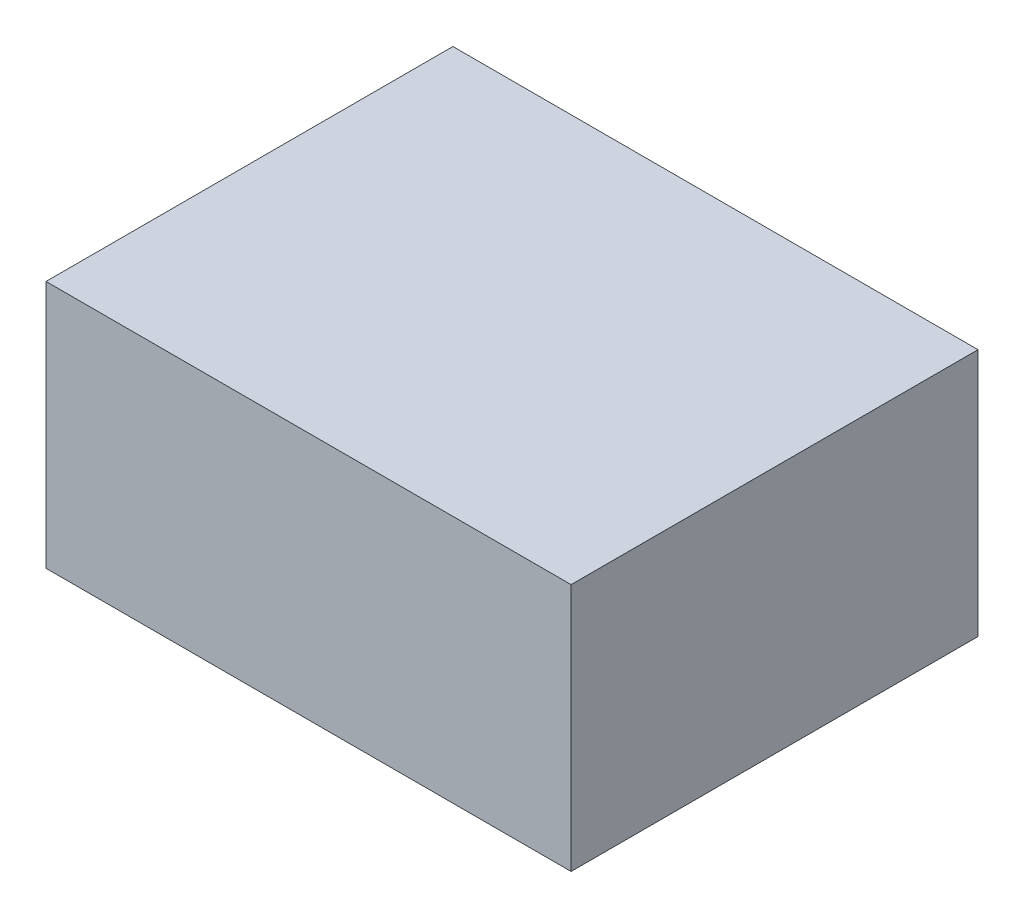
from build123d import *

# Parameters (mm, degrees)
SKETCH_1_W      = 391
SKETCH_1_H      = 185
EXTRUDE_1_DEPTH = 303


with BuildPart() as part:
    # 草图1 → 凸台-拉伸1 (new body)
    with BuildSketch(Plane.XY):
        Rectangle(SKETCH_1_W, SKETCH_1_H)
    extrude(amount=EXTRUDE_1_DEPTH)


solid = part.part
